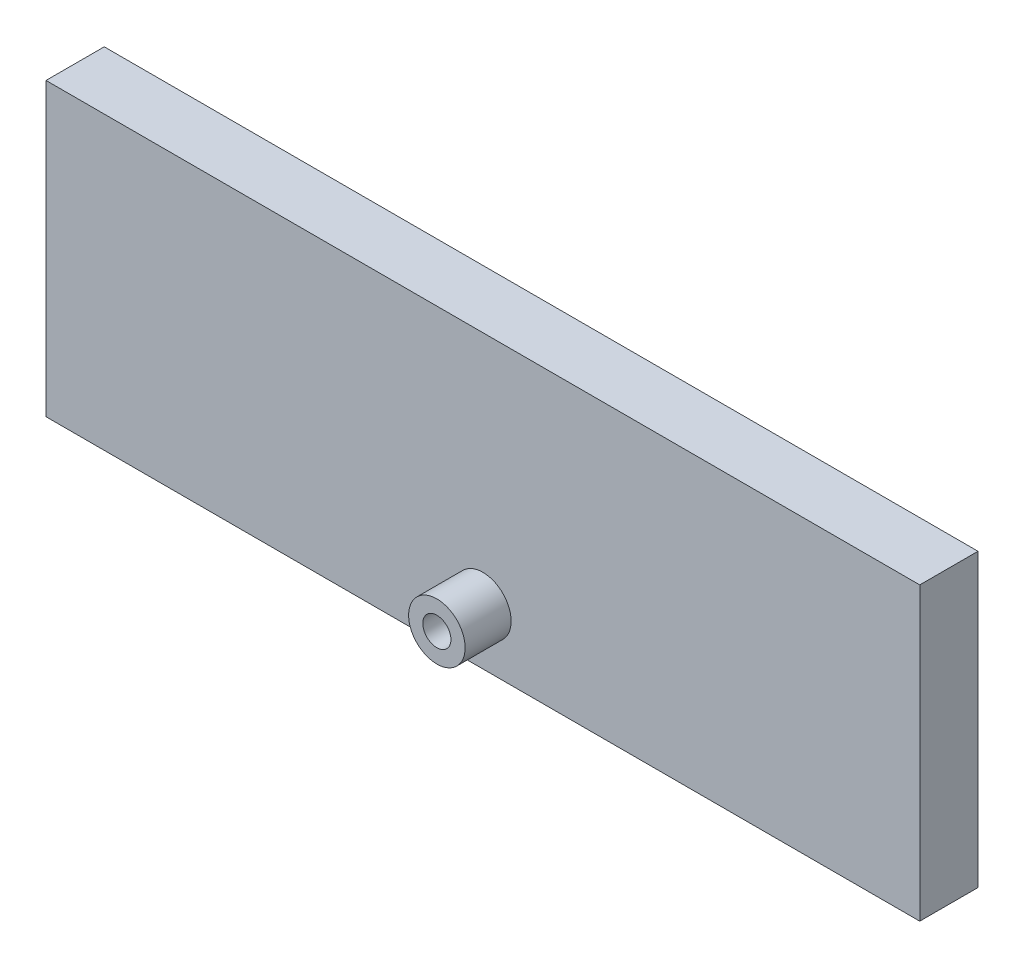
from build123d import *

# Parameters (mm, degrees)
SKETCH1_W           = 300
SKETCH1_H           = 100
BOSS_EXTRUDE1_DEPTH = 20
SKETCH2_R           = 9.7
SKETCH2_R_2         = 4.826
BOSS_EXTRUDE2_DEPTH = 15.8


with BuildPart() as part:
    # Sketch1 → Boss-Extrude1 (new body)
    with BuildSketch(Plane.XY):
        Rectangle(SKETCH1_W, SKETCH1_H)
    extrude(amount=BOSS_EXTRUDE1_DEPTH)

    # Sketch2 → Boss-Extrude2 (add)
    with BuildSketch(Plane.XY.offset(20)):
        with Locations((0, -30.95)):
            Circle(SKETCH2_R)
        with Locations((0, -30.95)):
            Circle(SKETCH2_R_2, mode=Mode.SUBTRACT)
    extrude(amount=BOSS_EXTRUDE2_DEPTH)


solid = part.part
